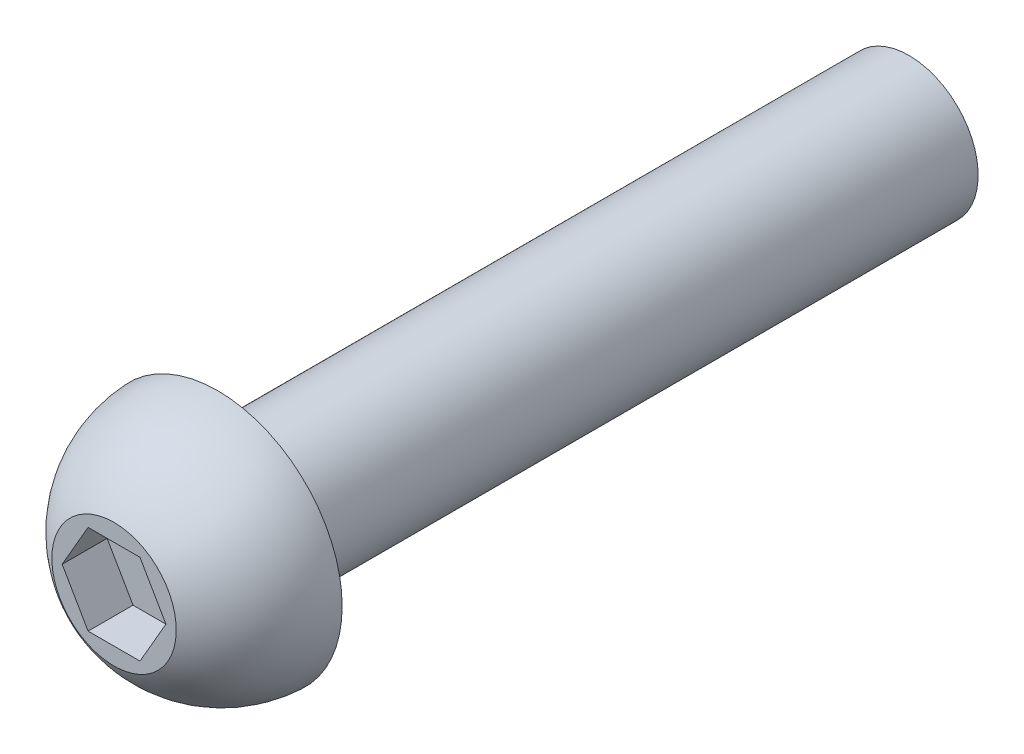
from build123d import *

# Parameters (mm, degrees)
CUT_EXTRUDE_1_DEPTH = 0.65


with BuildPart() as part:
    # 草图1 → 旋转1 (revolve)
    with BuildSketch(Plane(origin=(0, 0, 0), x_dir=(0, 0, -1), z_dir=(1, 0, 0))):
        with BuildLine():
            Line((0, 0), (0, 0.9))
            ThreePointArc((0, 0.9), (0.633393287, 1.544344521), (1.5, 1.8))
            Line((1.5, 1.8), (1.5, 1))
            Line((1.5, 1), (11.5, 1))
            Line((11.5, 1), (11.5, 0))
            Line((11.5, 0), (0, 0))
        make_face()
    revolve(axis=Axis((0, 0, 0), (0, 0, 1)))

    # 草图2 → 切除-拉伸1 (cut)
    with BuildSketch(Plane.XY):
        Polygon((0.75055535, 0), (0.375277675, 0.65), (-0.375277675, 0.65), (-0.75055535, 0), (-0.375277675, -0.65), (0.375277675, -0.65), align=None)
    extrude(amount=-CUT_EXTRUDE_1_DEPTH, mode=Mode.SUBTRACT)


solid = part.part
